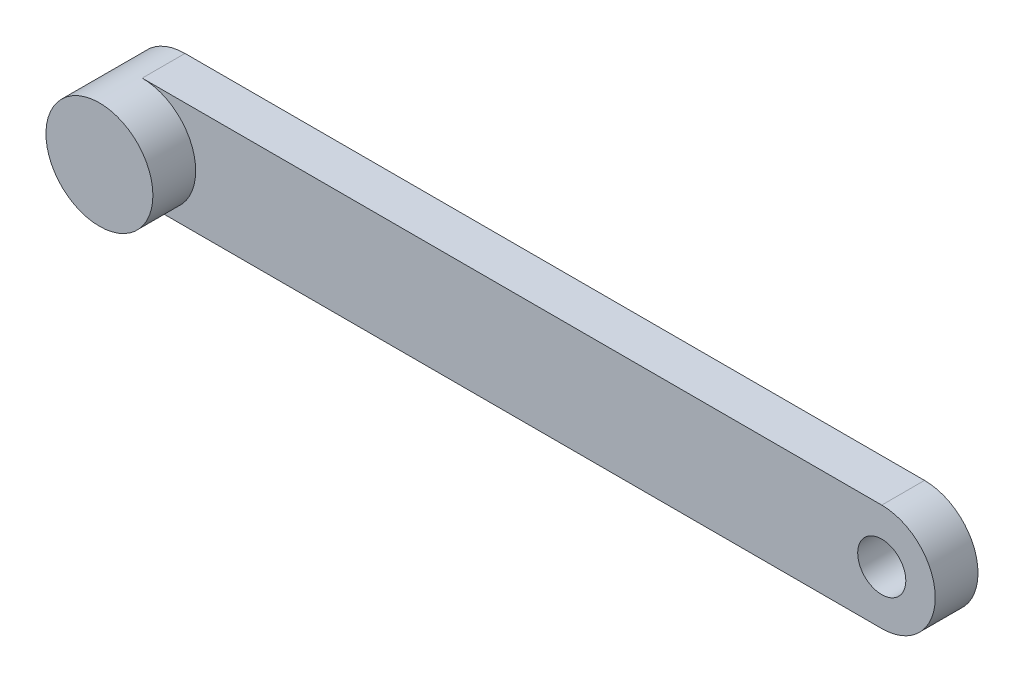
from build123d import *

# Parameters (mm, degrees)
BOSS_EXTRUDE1_DEPTH  = 2
SKETCH2_R            = 5
BOSS_EXTRUDE2_DEPTH  = 4
M4_CLEARANCE_HOLE1_D = 4.5


with BuildPart() as part:
    # Sketch1 → Boss-Extrude1 (new, symmetric)
    with BuildSketch(Plane.XY):
        with BuildLine():
            Line((0, 5), (69.15, 5))
            ThreePointArc((69.15, 5), (74.15, 0), (69.15, -5))
            Line((69.15, -5), (0, -5))
            ThreePointArc((0, -5), (-5, 0), (0, 5))
        make_face()
    extrude(amount=BOSS_EXTRUDE1_DEPTH, both=True)

    # Sketch2 → Boss-Extrude2 (add, symmetric)
    with BuildSketch(Plane.XY.offset(2)):
        with Locations(Location((0, 0, 0), (0, 0, 270))):
            Circle(SKETCH2_R)
    extrude(amount=BOSS_EXTRUDE2_DEPTH, both=True)

    # M4 Clearance Hole1 (through all)
    with Locations(Plane(origin=(0, 0, -2), x_dir=(-1, 0, 0), z_dir=(0, 0, -1))):
        with Locations((-69.15, 0)):
            Hole(M4_CLEARANCE_HOLE1_D / 2)


solid = part.part
